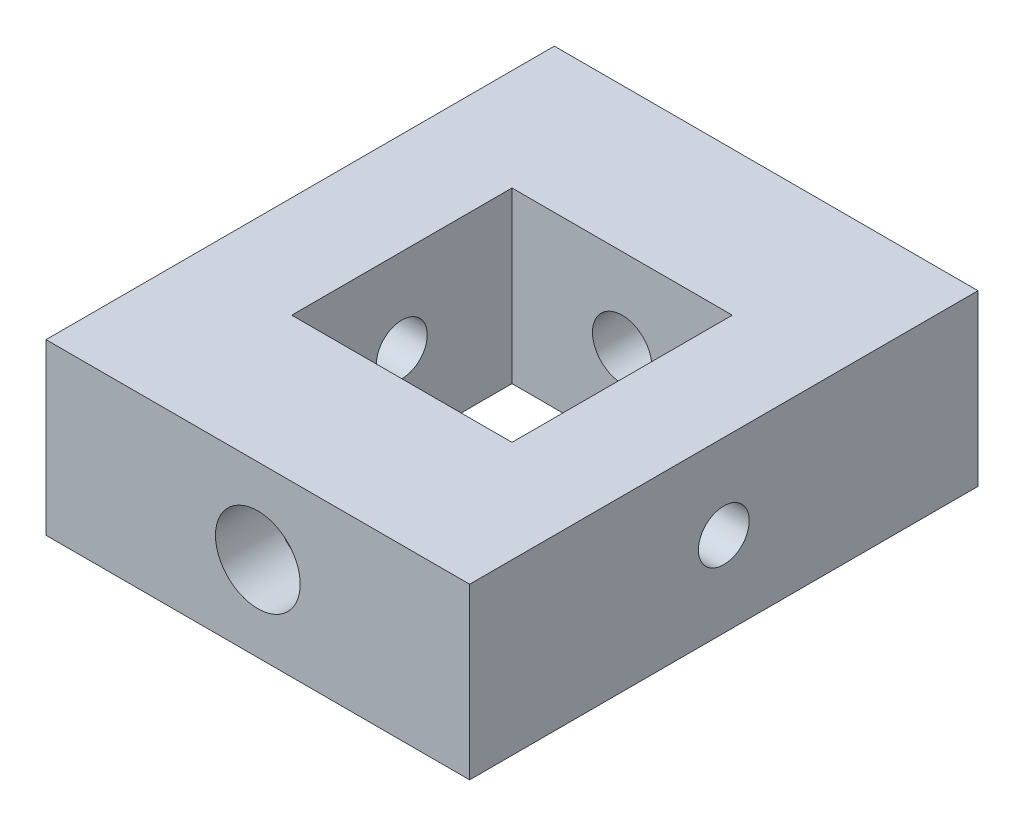
from build123d import *

# Parameters (mm, degrees)
SKETCH_1_W          = 10
SKETCH_1_H          = 12
SKETCH_1_W_2        = 5.2
SKETCH_1_H_2        = 5.2
EXTRUDE_1_DEPTH     = 4
SKETCH_2_R          = 0.6
CUT_EXTRUDE_1_DEPTH = 13.328828006
SKETCH_3_R          = 0.7
CUT_EXTRUDE_2_DEPTH = 14.601470509
SKETCH_3_3_R        = 1
CUT_EXTRUDE_3_DEPTH = 1.4
CUT_EXTRUDE_START   = -10.6
SKETCH_3_4_R        = 1
CUT_EXTRUDE_4_DEPTH = 1.4


with BuildPart() as part:
    # 草图1 → 凸台-拉伸1 (new body)
    with BuildSketch(Plane(origin=(0, 0, 0), x_dir=(1, 0, 0), z_dir=(0, 1, 0))):
        Rectangle(SKETCH_1_W, SKETCH_1_H)
        Rectangle(SKETCH_1_W_2, SKETCH_1_H_2, mode=Mode.SUBTRACT)
    extrude(amount=EXTRUDE_1_DEPTH)

    # 草图2 → 切除-拉伸1 (cut, through all)
    with BuildSketch(Plane(origin=(5, 0, 0), x_dir=(0, 0, -1), z_dir=(1, 0, 0))):
        with Locations((0, 2)):
            Circle(SKETCH_2_R)
    extrude(amount=-CUT_EXTRUDE_1_DEPTH, mode=Mode.SUBTRACT)

    # 草图3 → 切除-拉伸2 (cut, through all)
    with BuildSketch(Plane(origin=(0, 0, -6), x_dir=(-1, 0, 0), z_dir=(0, 0, -1))):
        with Locations((0, 2)):
            Circle(SKETCH_3_R)
    extrude(amount=-CUT_EXTRUDE_2_DEPTH, mode=Mode.SUBTRACT)

    # 草图3<3> → 切除-拉伸3 (cut)
    with BuildSketch(Plane(origin=(0, 0, -6), x_dir=(-1, 0, 0), z_dir=(0, 0, -1))):
        with Locations((0, 2)):
            Circle(SKETCH_3_3_R)
    extrude(amount=-CUT_EXTRUDE_3_DEPTH, mode=Mode.SUBTRACT)

    # 草图3<4> → 切除-拉伸4 (cut)
    with BuildSketch(Plane(origin=(0, 0, -6), x_dir=(-1, 0, 0), z_dir=(0, 0, -1)).offset(CUT_EXTRUDE_START)):
        with Locations((0, 2)):
            Circle(SKETCH_3_4_R)
    extrude(amount=-CUT_EXTRUDE_4_DEPTH, mode=Mode.SUBTRACT)


solid = part.part
